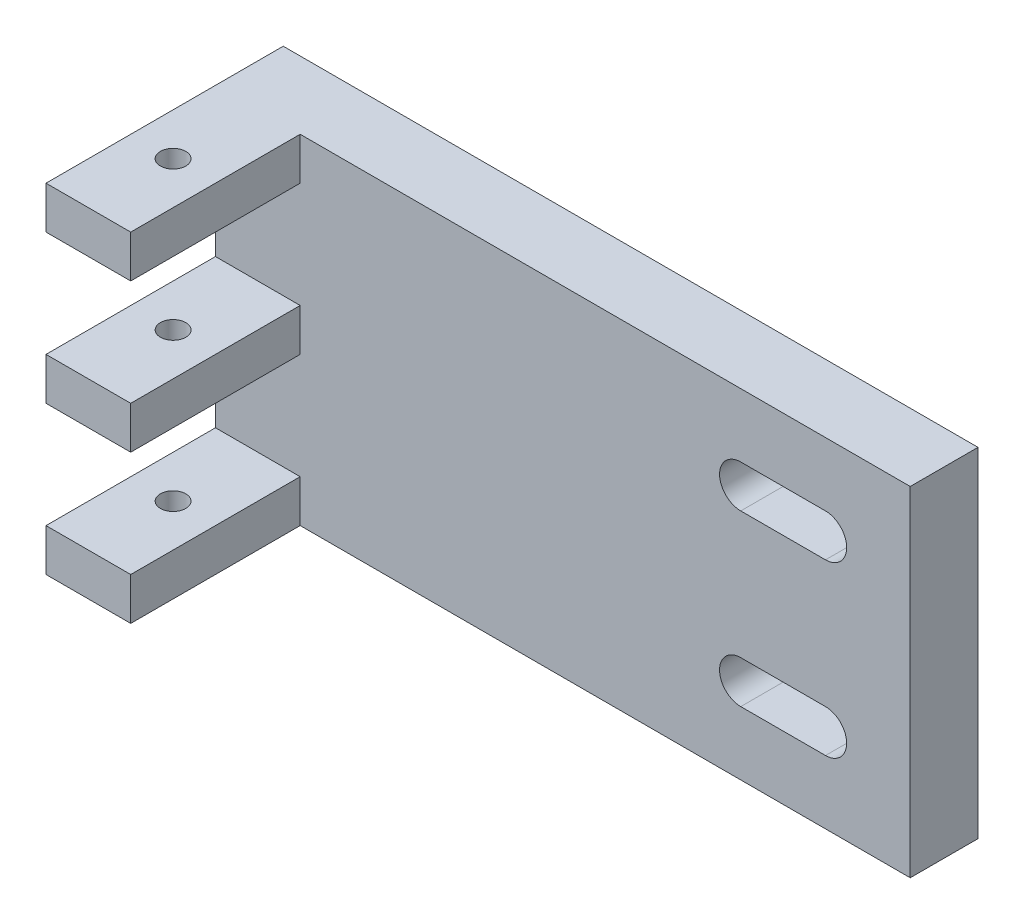
from build123d import *

# Parameters (mm, degrees)
SKETCH_1_W          = 82
SKETCH_1_H          = 40
EXTRUDE_1_DEPTH     = 8
SKETCH_3_W          = 10
SKETCH_3_H          = 5
EXTRUDE_3_DEPTH     = 20
SKETCH_4_R          = 1.5
CUT_EXTRUDE_1_DEPTH = 47


with BuildPart() as part:
    # 草图1 → 凸台-拉伸1 (new body)
    with BuildSketch(Plane.XY):
        with Locations((15.184210526, 10.907894737)):
            Rectangle(SKETCH_1_W, SKETCH_1_H)
        with BuildLine():
            Line((46.184210526, -1.592105263), (36.184210526, -1.592105263))
            ThreePointArc((36.184210526, -1.592105263), (33.684210526, 0.907894737), (36.184210526, 3.407894737))
            Line((36.184210526, 3.407894737), (46.184210526, 3.407894737))
            ThreePointArc((46.184210526, 3.407894737), (48.684210526, 0.907894737), (46.184210526, -1.592105263))
        make_face(mode=Mode.SUBTRACT)
        with BuildLine():
            Line((46.184210526, 18.407894737), (36.184210526, 18.407894737))
            ThreePointArc((36.184210526, 18.407894737), (33.684210526, 20.907894737), (36.184210526, 23.407894737))
            Line((36.184210526, 23.407894737), (46.184210526, 23.407894737))
            ThreePointArc((46.184210526, 23.407894737), (48.684210526, 20.907894737), (46.184210526, 18.407894737))
        make_face(mode=Mode.SUBTRACT)
    extrude(amount=EXTRUDE_1_DEPTH)

    # 草图3 → 凸台-拉伸3 (add)
    with BuildSketch(Plane.XY.offset(8)):
        with Locations((-20.815789474, 28.407894737)):
            Rectangle(SKETCH_3_W, SKETCH_3_H)
        with Locations((-20.815789474, -6.592105263)):
            Rectangle(SKETCH_3_W, SKETCH_3_H)
        with Locations((-20.815789474, 10.907894737)):
            Rectangle(SKETCH_3_W, SKETCH_3_H)
    extrude(amount=EXTRUDE_3_DEPTH)

    # 草图4 → 切除-拉伸1 (cut)
    with BuildSketch(Plane(origin=(0, 30.907894737, 0), x_dir=(1, 0, 0), z_dir=(0, 1, 0))):
        with Locations(Location((-20.815789474, -18, 0), (0, 0, 270))):
            Circle(SKETCH_4_R)
    extrude(amount=-CUT_EXTRUDE_1_DEPTH, mode=Mode.SUBTRACT)


solid = part.part
